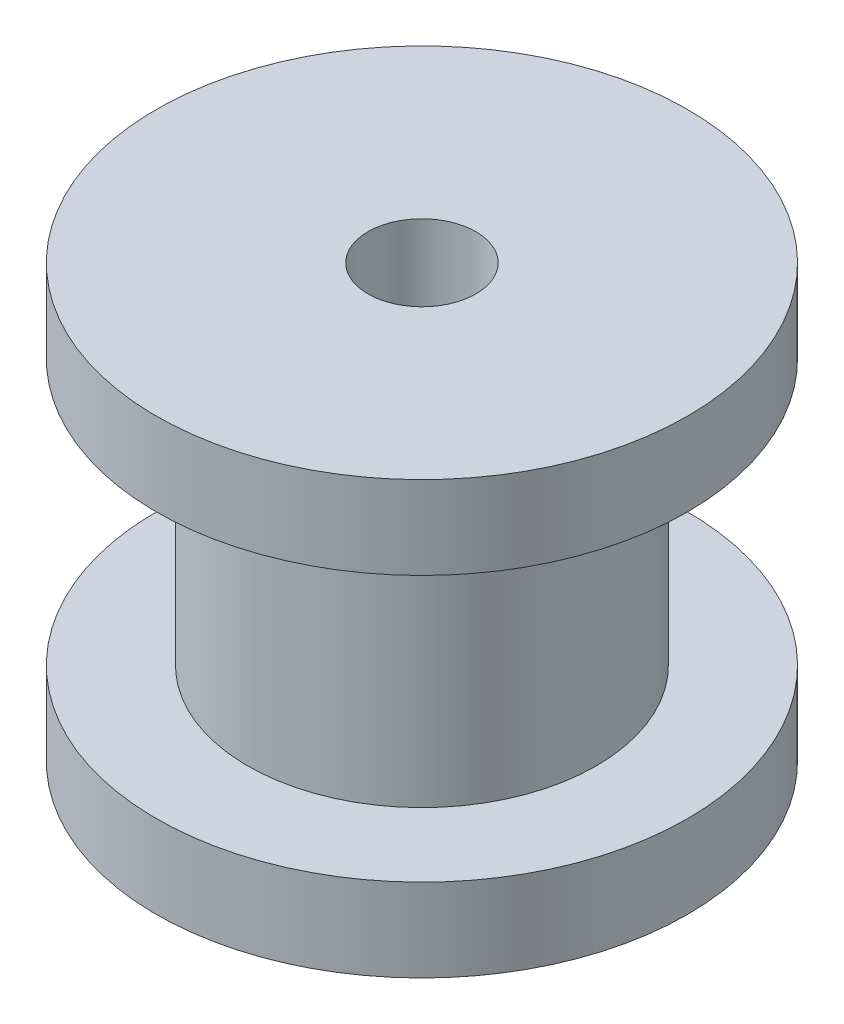
from build123d import *

# Parameters (mm, degrees)
SKETCH2_R          = 1.625
CUT_EXTRUDE1_DEPTH = 18.23368794


with BuildPart() as part:
    # Sketch1 → Revolve1 (revolve)
    with BuildSketch(Plane.XY):
        Polygon((0, -6.5), (0, 6.5), (8, 6.5), (8, 4), (5.25, 4), (5.25, -4), (8, -4), (8, -6.5), align=None)
    revolve(axis=Axis((0, -6.5, 0), (0, 1, 0)))

    # Sketch2 → Cut-Extrude1 (cut, through all)
    with BuildSketch(Plane(origin=(0, 6.5, 0), x_dir=(1, 0, 0), z_dir=(0, 1, 0))):
        with Locations(Location((0, 0, 0), (0, 0, 180))):
            Circle(SKETCH2_R)
    extrude(amount=-CUT_EXTRUDE1_DEPTH, mode=Mode.SUBTRACT)


solid = part.part
